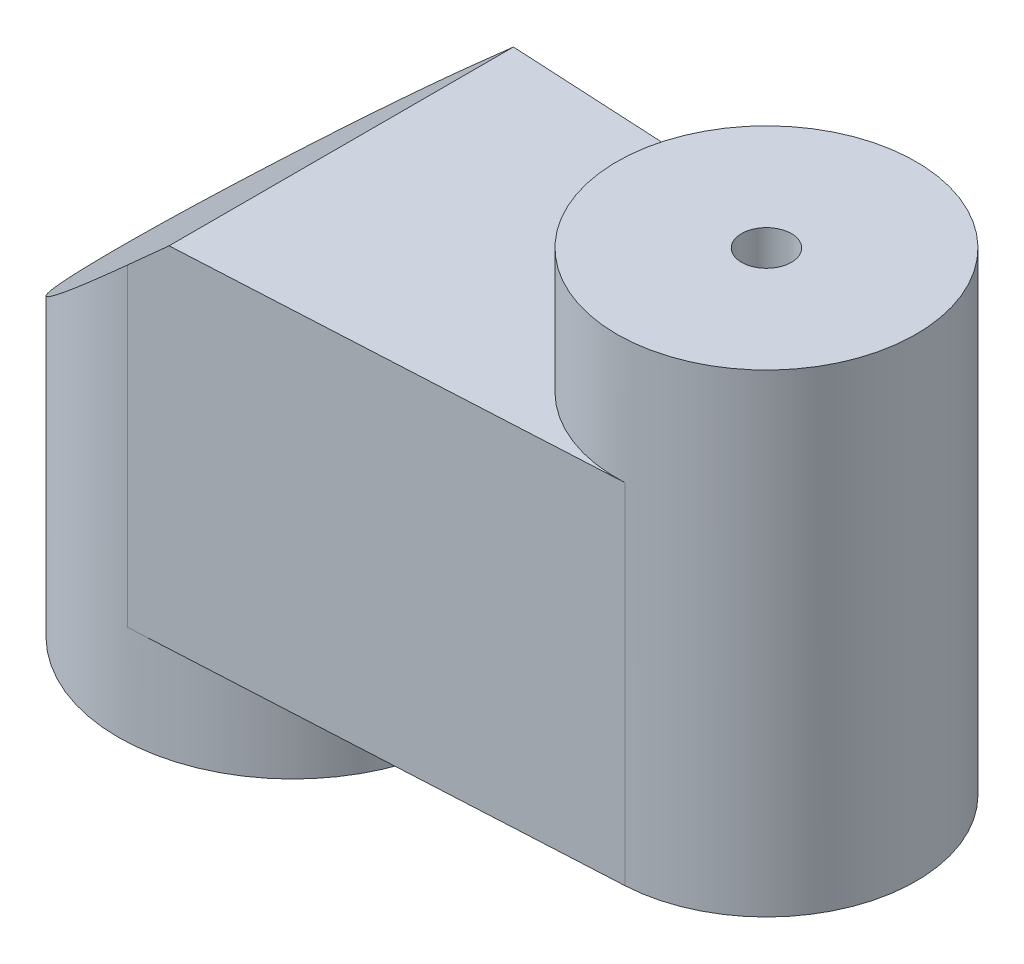
from build123d import *

# Parameters (mm, degrees)
SKETCH_1_R          = 35
EXTRUDE_1_DEPTH     = 20
EXTRUDE_2_DEPTH     = 70
SKETCH_4_R          = 30
EXTRUDE_3_DEPTH     = 25
CUT_EXTRUDE_1_DEPTH = 44
SKETCH_6_R          = 5
CUT_EXTRUDE_2_DEPTH = 174.42145196


with BuildPart() as part:
    # 草图1 → 凸台-拉伸1 (new body)
    with BuildSketch(Plane(origin=(0, 0, 0), x_dir=(1, 0, 0), z_dir=(0, 1, 0))):
        with Locations(Location((0, 0, 0), (0, 0, 270))):
            Circle(SKETCH_1_R)
    extrude(amount=EXTRUDE_1_DEPTH)

    # 草图3 → 凸台-拉伸2 (add)
    with BuildSketch(Plane(origin=(0, 20, 0), x_dir=(1, 0, 0), z_dir=(0, 1, 0))):
        with BuildLine():
            Line((1.842105263, 34.951489928), (96.578947368, 29.958419938))
            ThreePointArc((96.578947368, 29.958419938), (125, 0), (96.578947368, -29.958419938))
            Line((96.578947368, -29.958419938), (1.842105263, -34.951489928))
            ThreePointArc((1.842105263, -34.951489928), (-35, 0), (1.842105263, 34.951489928))
        make_face()
    extrude(amount=EXTRUDE_2_DEPTH)

    # 草图4 → 凸台-拉伸3 (add)
    with BuildSketch(Plane(origin=(0, 90, 0), x_dir=(1, 0, 0), z_dir=(0, 1, 0))):
        with Locations(Location((95, 0, 0), (0, 0, 86.98303869))):
            Circle(SKETCH_4_R)
    extrude(amount=EXTRUDE_3_DEPTH)

    # 草图5 → 切除-拉伸1 (cut, symmetric)
    with BuildSketch(Plane.XY):
        Polygon((9.72135955, 90), (-35, 50), (-35, 90), align=None)
    extrude(amount=CUT_EXTRUDE_1_DEPTH, both=True, mode=Mode.SUBTRACT)

    # 草图6 → 切除-拉伸2 (cut, through all)
    with BuildSketch(Plane(origin=(0, 115, 0), x_dir=(1, 0, 0), z_dir=(0, 1, 0))):
        with Locations(Location((95, 0, 0), (0, 0, 270))):
            Circle(SKETCH_6_R)
    extrude(amount=-CUT_EXTRUDE_2_DEPTH, mode=Mode.SUBTRACT)


solid = part.part
